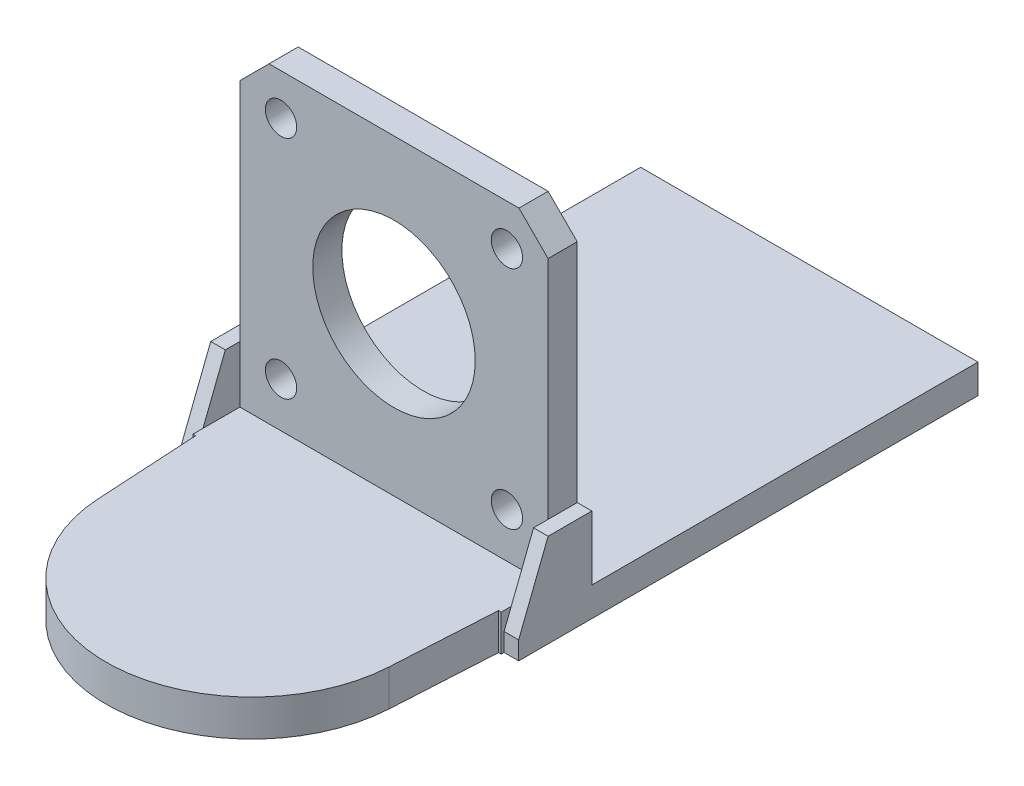
from build123d import *

# Parameters (mm, degrees)
SKETCH_5_W                = 42.3
SKETCH_5_H                = 50.3
SKETCH_5_R                = 11.15
SKETCH_5_R_2              = 2.15
EXTRUDE_2_DEPTH           = 4
EXTRUDE_3_DEPTH           = 4
SKETCH_7_R                = 1.7
CUT_EXTRUDE_3_DEPTH       = 4
CHAMFER_1_SIZE            = 4
EXTRUDE_4_DEPTH           = 2
EXTRUDE_5_REACH           = 79.8
EXTRUDE_6_REACH           = 80.956
SKETCH_12_W               = 46.3
SKETCH_12_H               = 3
EXTRUDE_7_DEPTH           = 53
EXTRUDE_9_DEPTH           = 4
CUT_EXTRUDE_4_DEPTH       = 5
SKETCH_17_R               = 5.175
EXTRUDE_10_DEPTH          = 15
SKETCH_18_R               = 1.6
CUT_EXTRUDE_6_DEPTH       = 15
F_2_0MM_1_D               = 3.1
F_2_0MM_1_DEPTH           = 4.45
F_2_0MM_1_TIP             = 1.55
F_2_0MM_1_ON_FACE_2_D     = 3.1
F_2_0MM_1_ON_FACE_2_DEPTH = 4.45
F_2_0MM_1_ON_FACE_2_TIP   = 1.55
F_2_0MM_1_ON_FACE_3_D     = 3.1
F_2_0MM_1_ON_FACE_3_DEPTH = 4.45
F_2_0MM_1_ON_FACE_3_TIP   = 1.55
SKETCH_21_W               = 46.3
SKETCH_21_H               = 53
CUT_EXTRUDE_7_DEPTH       = 1.5
CUT_EXTRUDE_START         = -0.5
CUT_EXTRUDE_8_DEPTH       = 0.5
EXTRUDE_START             = 2.5
EXTRUDE_11_DEPTH          = 2.5


with BuildPart() as part:
    # 草图5 → 凸台-拉伸2 (new body)
    with BuildSketch(Plane.XY):
        with Locations((0, 25.15)):
            Rectangle(SKETCH_5_W, SKETCH_5_H)
        with Locations((0, 29.15)):
            Circle(SKETCH_5_R, mode=Mode.SUBTRACT)
        with Locations((15.5, 44.65)):
            Circle(SKETCH_5_R_2, mode=Mode.SUBTRACT)
        with Locations((15.5, 13.65)):
            Circle(SKETCH_5_R_2, mode=Mode.SUBTRACT)
        with Locations((-15.5, 13.65)):
            Circle(SKETCH_5_R_2, mode=Mode.SUBTRACT)
        with Locations((-15.5, 44.65)):
            Circle(SKETCH_5_R_2, mode=Mode.SUBTRACT)
    extrude(amount=-EXTRUDE_2_DEPTH)

    # 草图6 → 凸台-拉伸3 (add)
    with BuildSketch(Plane.XZ):
        with BuildLine():
            Line((-21.15, 0), (-19.967256346, 20.643972909))
            ThreePointArc((-19.967256346, 20.643972909), (0, 39.5), (19.967256346, 20.643972909))
            Line((19.967256346, 20.643972909), (21.15, 0))
            Line((21.15, 0), (-21.15, 0))
        make_face()
    extrude(amount=-EXTRUDE_3_DEPTH)

    # 草图7 → 切除-拉伸3 (cut)
    with BuildSketch(Plane(origin=(0, 4, 0), x_dir=(1, 0, 0), z_dir=(0, 1, 0))):
        with Locations((0, -5.5)):
            Circle(SKETCH_7_R)
        with Locations((12.124355653, -12.5)):
            Circle(SKETCH_7_R)
        with Locations((12.124355653, -26.5)):
            Circle(SKETCH_7_R)
        with Locations((0, -33.5)):
            Circle(SKETCH_7_R)
        with Locations((-12.124355653, -26.5)):
            Circle(SKETCH_7_R)
        with Locations((-12.124355653, -12.5)):
            Circle(SKETCH_7_R)
    extrude(amount=-CUT_EXTRUDE_3_DEPTH, mode=Mode.SUBTRACT)

    # 倒角1
    chamfer_1_edges = [part.edges().sort_by_distance(p)[0] for p in [
        (21.15, 50.3, -2),
        (-21.15, 50.3, -2),
    ]]
    chamfer(chamfer_1_edges, length=CHAMFER_1_SIZE)

    # 草图9 → 凸台-拉伸4 (add)
    with BuildSketch(Plane.ZY.offset(21.15)):
        Polygon((-4, 0), (8, 0), (2, 15.3), (-4, 15.3), align=None)
    extrude_4 = extrude(amount=EXTRUDE_4_DEPTH)

    # 凸台-拉伸5: up to this plane
    extrude_5_end = Plane(origin=(-21.15, 4, 0), z_dir=(-0.9983628172970396, 0, 0.05719864542730192))
    # 草图10 → 凸台-拉伸5 (add, up to the surface)
    with BuildSketch(Plane.ZY.offset(23.15), mode=Mode.PRIVATE) as extrude_5_sk1:
        Polygon((-4, 0), (8, 0), (6.431372549, 4), (-4, 4), align=None)
    extrude_5_tool1 = split(extrude(extrude_5_sk1.sketch, amount=-EXTRUDE_5_REACH, mode=Mode.PRIVATE), bisect_by=extrude_5_end, keep=Keep.BOTH, mode=Mode.PRIVATE)
    add(extrude_5_tool1.solids().sort_by_distance((-23.15, 1.95338, 1.616984))[0])

    # 镜向2: 凸台-拉伸4 across plane
    add(extrude_4.mirror(Plane(origin=(0, 0, 0), x_dir=(0, 0, 1), z_dir=(1, 0, 0))))

    # 凸台-拉伸6: up to this plane
    extrude_6_end = Plane(origin=(21.15, 4, 0), z_dir=(0.9983628172970396, 0, 0.05719864542730192))
    # 草图11 → 凸台-拉伸6 (add, up to the surface)
    with BuildSketch(Plane(origin=(23.15, 0, 0), x_dir=(0, 0, -1), z_dir=(1, 0, 0)), mode=Mode.PRIVATE) as extrude_6_sk1:
        Polygon((-6.431372549, 4), (4, 4), (4, 0), (-8, 0), align=None)
    extrude_6_tool1 = split(extrude(extrude_6_sk1.sketch, amount=-EXTRUDE_6_REACH, mode=Mode.PRIVATE), bisect_by=extrude_6_end, keep=Keep.BOTH, mode=Mode.PRIVATE)
    add(extrude_6_tool1.solids().sort_by_distance((23.15, 1.95338, 1.616984))[0])

    # 草图12 → 凸台-拉伸7 (add)
    with BuildSketch(Plane(origin=(0, 0, -4), x_dir=(-1, 0, 0), z_dir=(0, 0, -1))):
        with Locations((0, 6.5)):
            Rectangle(SKETCH_12_W, SKETCH_12_H)
    extrude(amount=EXTRUDE_7_DEPTH)

    # 草图14 → 凸台-拉伸9 (add)
    with BuildSketch(Plane(origin=(0, 4, 0), x_dir=(1, 0, 0), z_dir=(0, 1, 0))):
        with BuildLine():
            Line((21.15, 0), (-21.15, 0))
            Line((-21.15, 0), (-21.15, -6.431372549))
            Line((-21.15, -6.431372549), (-20.781530951, -6.431372549))
            Line((-20.781530951, -6.431372549), (-19.967256346, -20.643972909))
            ThreePointArc((-19.967256346, -20.643972909), (0, -39.5), (19.967256346, -20.643972909))
            Line((19.967256346, -20.643972909), (20.781530951, -6.431372549))
            Line((20.781530951, -6.431372549), (21.15, -6.431372549))
            Line((21.15, -6.431372549), (21.15, 0))
        make_face()
    extrude(amount=EXTRUDE_9_DEPTH)

    # 草图15 → 切除-拉伸4 (cut)
    with BuildSketch(Plane.XZ):
        with BuildLine():
            Line((-23.15, -4), (23.15, -4))
            Line((23.15, -4), (23.15, 8))
            Line((23.15, 8), (20.691660451, 8))
            Line((20.691660451, 8), (19.967256346, 20.643972909))
            ThreePointArc((19.967256346, 20.643972909), (0, 39.5), (-19.967256346, 20.643972909))
            Line((-19.967256346, 20.643972909), (-20.691660451, 8))
            Line((-20.691660451, 8), (-23.15, 8))
            Line((-23.15, 8), (-23.15, -4))
        make_face()
    extrude(amount=-CUT_EXTRUDE_4_DEPTH, mode=Mode.SUBTRACT)

    # 草图17 → 凸台-拉伸10 (add)
    with BuildSketch(Plane(origin=(0, 8, 0), x_dir=(1, 0, 0), z_dir=(0, 1, 0))):
        with Locations((0, 16.5)):
            Circle(SKETCH_17_R)
    extrude(amount=-EXTRUDE_10_DEPTH)

    # 草图18 → 切除-拉伸6 (cut)
    with BuildSketch(Plane.XZ.offset(7)):
        with Locations((0, -16.5)):
            Circle(SKETCH_18_R)
    extrude(amount=-CUT_EXTRUDE_6_DEPTH, mode=Mode.SUBTRACT)

    # Ø2.0mm 暗销孔1
    with Locations(Plane(origin=(-2.383959963, -1.470142013, -11.906813753), x_dir=(0.887572221549, 0, 0.46066859187), z_dir=(-0.46066859187, 0, 0.887572221549))):
        with Locations((0, 0)):
            Hole(F_2_0MM_1_D / 2, depth=F_2_0MM_1_DEPTH)
            with Locations((0, 0, -(F_2_0MM_1_DEPTH + F_2_0MM_1_TIP / 2))):  # 90° drill point
                Cone(0, F_2_0MM_1_D / 2, F_2_0MM_1_TIP, mode=Mode.SUBTRACT)

    # Ø2.0mm 暗销孔1 on face 2
    with Locations(Plane(origin=(-4.001379199, -1.359919587, -19.781705274), x_dir=(0.634146160856, 0, -0.773213196131), z_dir=(-0.773213196131, 0, -0.634146160856))):
        with Locations((-1e-09, 0)):
            Hole(F_2_0MM_1_ON_FACE_2_D / 2, depth=F_2_0MM_1_ON_FACE_2_DEPTH)
            with Locations((0, 0, -(F_2_0MM_1_ON_FACE_2_DEPTH + F_2_0MM_1_ON_FACE_2_TIP / 2))):  # 90° drill point
                Cone(0, F_2_0MM_1_ON_FACE_2_D / 2, F_2_0MM_1_ON_FACE_2_TIP, mode=Mode.SUBTRACT)

    # Ø2.0mm 暗销孔1 on face 3
    with Locations(Plane(origin=(4.74207792, -1.268589172, -18.572033301), x_dir=(0.40039282367, 0, 0.916343596449), z_dir=(0.916343596449, 0, -0.40039282367))):
        with Locations((0, 0)):
            Hole(F_2_0MM_1_ON_FACE_3_D / 2, depth=F_2_0MM_1_ON_FACE_3_DEPTH)
            with Locations((0, 0, -(F_2_0MM_1_ON_FACE_3_DEPTH + F_2_0MM_1_ON_FACE_3_TIP / 2))):  # 90° drill point
                Cone(0, F_2_0MM_1_ON_FACE_3_D / 2, F_2_0MM_1_ON_FACE_3_TIP, mode=Mode.SUBTRACT)

    # 草图21 → 切除-拉伸7 (cut)
    with BuildSketch(Plane(origin=(0, 8, 0), x_dir=(1, 0, 0), z_dir=(0, 1, 0))):
        with Locations((0, 30.5)):
            Rectangle(SKETCH_21_W, SKETCH_21_H)
    extrude(amount=-CUT_EXTRUDE_7_DEPTH, mode=Mode.SUBTRACT)

    # 草图22 → 切除-拉伸8 (cut)
    with BuildSketch(Plane(origin=(0, 8, 0), x_dir=(1, 0, 0), z_dir=(0, 1, 0)).offset(CUT_EXTRUDE_START)):
        with BuildLine():
            Line((21.15, -6.431372549), (21.15, -4.862745098))
            Line((21.15, -4.862745098), (21.15, 0))
            Line((21.15, 0), (-21.15, 0))
            Line((-21.15, 0), (-21.15, -4.862745098))
            Line((-21.15, -4.862745098), (-21.15, -6.431372549))
            Line((-21.15, -6.431372549), (-20.781530951, -6.431372549))
            Line((-20.781530951, -6.431372549), (-19.967256346, -20.643972909))
            ThreePointArc((-19.967256346, -20.643972909), (0, -39.5), (19.967256346, -20.643972909))
            Line((19.967256346, -20.643972909), (20.781530951, -6.431372549))
            Line((20.781530951, -6.431372549), (21.15, -6.431372549))
        make_face()
    extrude(amount=CUT_EXTRUDE_8_DEPTH, mode=Mode.SUBTRACT)

    # 草图23 → 凸台-拉伸11 (add)
    with BuildSketch(Plane.XZ.offset(-5).offset(EXTRUDE_START)):
        with BuildLine():
            Line((23.15, -57), (23.15, 6.039215686))
            Line((23.15, 6.039215686), (21.15, 6.039215686))
            Line((21.15, 6.039215686), (21.15, 6.431372549))
            Line((21.15, 6.431372549), (20.781530951, 6.431372549))
            Line((20.781530951, 6.431372549), (19.967256346, 20.643972909))
            ThreePointArc((19.967256346, 20.643972909), (0, 39.5), (-19.967256346, 20.643972909))
            Line((-19.967256346, 20.643972909), (-20.781530951, 6.431372549))
            Line((-20.781530951, 6.431372549), (-21.15, 6.431372549))
            Line((-21.15, 6.431372549), (-21.15, 6.039215686))
            Line((-21.15, 6.039215686), (-23.15, 6.039215686))
            Line((-23.15, 6.039215686), (-23.15, -57))
            Line((-23.15, -57), (23.15, -57))
        make_face()
    extrude(amount=-EXTRUDE_11_DEPTH)


solid = part.part
